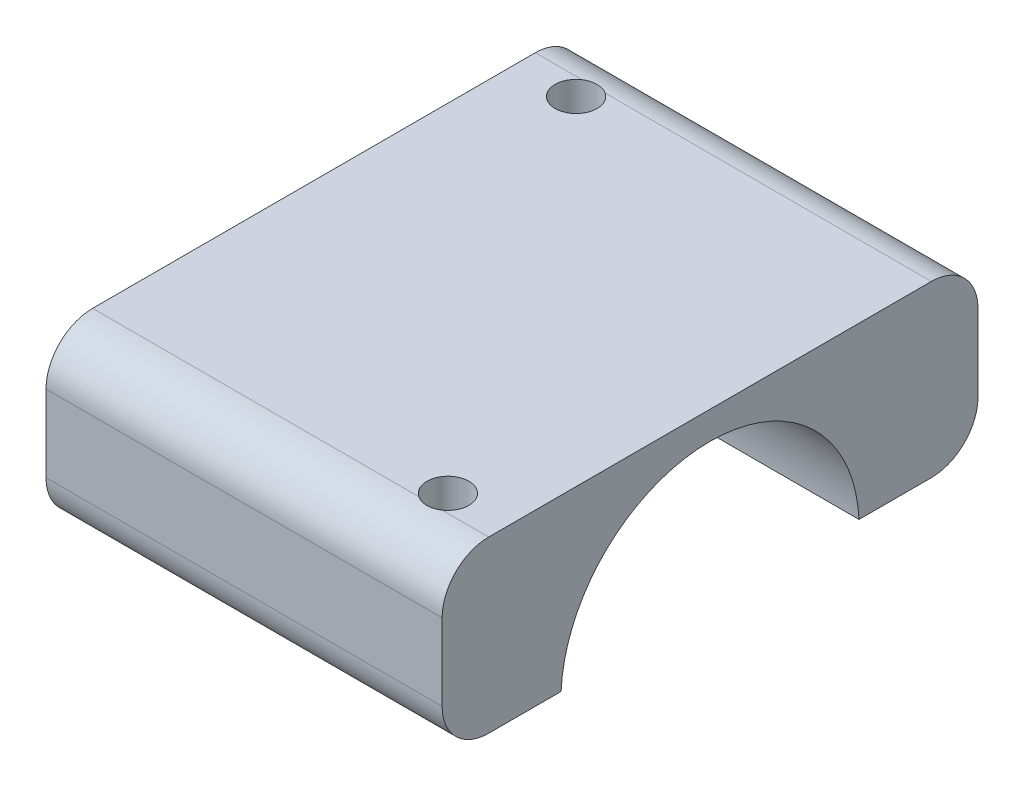
from build123d import *

# Parameters (mm, degrees)
BOSS_EXTRUDE1_DEPTH     = 17
CUT_EXTRUDE1_DEPTH      = 33.383257156
CUT_EXTRUDE1_DEPTH_BACK = 33.383257156
SKETCH2_R               = 12.8
SKETCH3_R               = 1.8
CUT_EXTRUDE2_DEPTH      = 15.188


with BuildPart() as part:
    # Sketch1 → Boss-Extrude1 (new, symmetric)
    with BuildSketch(Plane(origin=(0, 0, 0), x_dir=(0, 0, -1), z_dir=(1, 0, 0))):
        with BuildLine():
            Line((-19, 0.6), (19, 0.6))
            ThreePointArc((19, 0.6), (21.828427125, 1.771572875), (23, 4.6))
            Line((23, 4.6), (23, 11.188))
            ThreePointArc((23, 11.188), (21.828427125, 14.016427125), (19, 15.188))
            Line((19, 15.188), (-19, 15.188))
            ThreePointArc((-19, 15.188), (-21.828427125, 14.016427125), (-23, 11.188))
            Line((-23, 11.188), (-23, 4.6))
            ThreePointArc((-23, 4.6), (-21.828427125, 1.771572875), (-19, 0.6))
        make_face()
    extrude(amount=BOSS_EXTRUDE1_DEPTH, both=True)

    # Sketch2 → Cut-Extrude1 (cut, two sides: drawn at the far end of the back side and taken through both)
    with BuildSketch(Plane(origin=(0, 0, 0), x_dir=(0, 0, -1), z_dir=(1, 0, 0)).offset(-CUT_EXTRUDE1_DEPTH_BACK)):
        Circle(SKETCH2_R)
    extrude(amount=CUT_EXTRUDE1_DEPTH + CUT_EXTRUDE1_DEPTH_BACK, mode=Mode.SUBTRACT)

    # Sketch3 → Cut-Extrude2 (cut)
    with BuildSketch(Plane(origin=(0, 0.6, 0), x_dir=(1, 0, 0), z_dir=(0, 1, 0))):
        with Locations(Location((12, -17.5, 0), (0, 0, 236.442690238))):
            Circle(SKETCH3_R)
        with Locations(Location((-12, 17.5, 0), (0, 0, 123.557309762))):
            Circle(SKETCH3_R)
    extrude(amount=CUT_EXTRUDE2_DEPTH, mode=Mode.SUBTRACT)


solid = part.part
